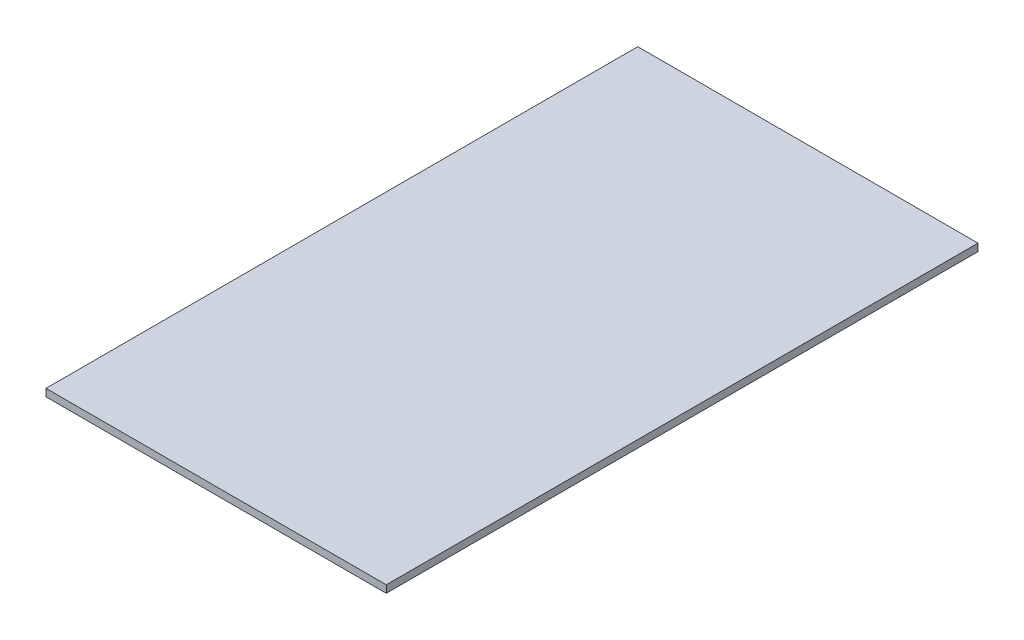
from build123d import *

# Parameters (mm, degrees)
SKETCH1_W           = 292.1
SKETCH1_H           = 508
BOSS_EXTRUDE1_DEPTH = 6.35


with BuildPart() as part:
    # Sketch1 → Boss-Extrude1 (new body)
    with BuildSketch(Plane(origin=(0, 0, 0), x_dir=(1, 0, 0), z_dir=(0, 1, 0))):
        with Locations((146.977170591, 231.004856512)):
            Rectangle(SKETCH1_W, SKETCH1_H)
    extrude(amount=BOSS_EXTRUDE1_DEPTH)


solid = part.part
